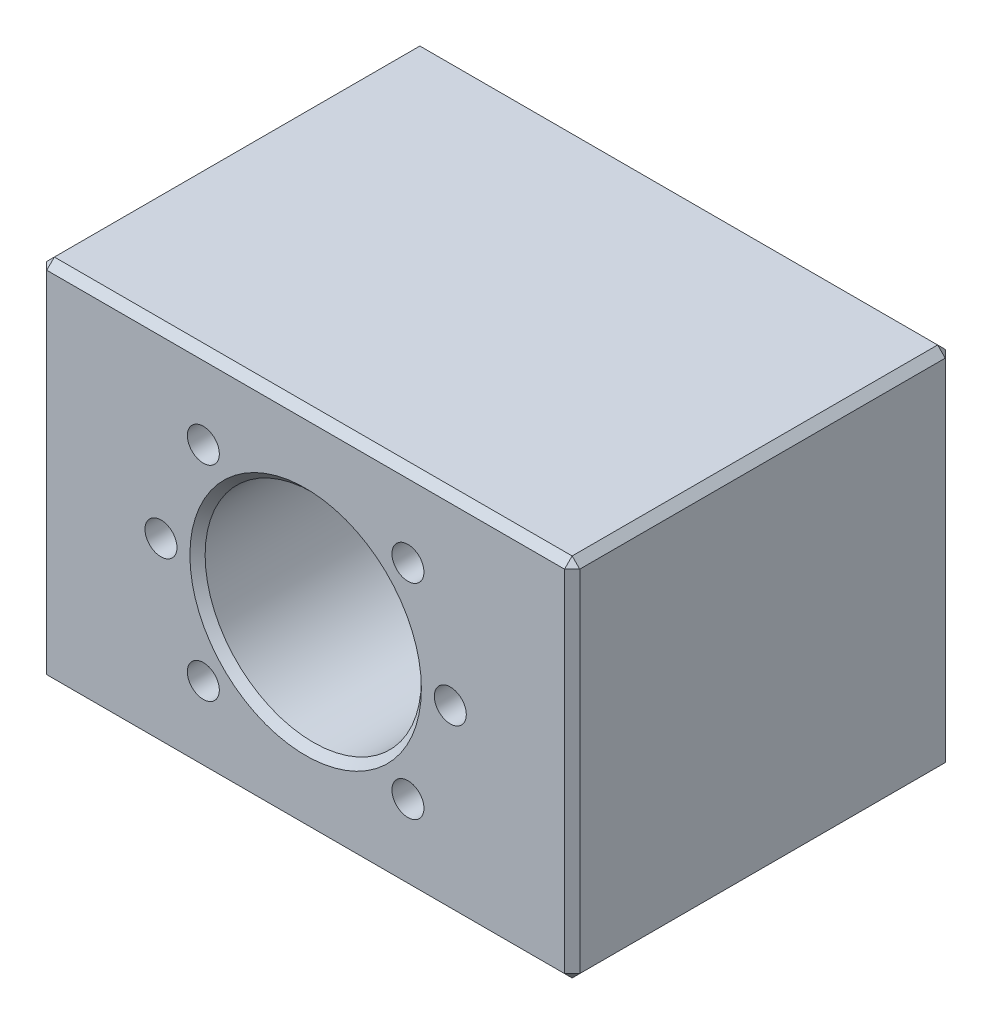
from build123d import *

# Parameters (mm, degrees)
ESQUISSE1_W                                        = 70
ESQUISSE1_H                                        = 50
BOSS_EXTRU_1_DEPTH                                 = 48
D_GAGEMENT_M251_D                                  = 28.4
DIAM_TRE_DU_PER_AGE_4_2_4_2_1_D                    = 4.2
DIAM_TRE_DU_PER_AGE_4_2_4_2_1_DEPTH                = 14
DIAM_TRE_DU_PER_AGE_4_2_4_2_1_TIP                  = 1.2618073
CHAMBRAGE_POUR_VIS_T_TE_HEXAGONALE_M81_D           = 8.6
CHAMBRAGE_POUR_VIS_T_TE_HEXAGONALE_M81_DEPTH       = 20
CHAMBRAGE_POUR_VIS_T_TE_HEXAGONALE_M81_CBORE_D     = 14
CHAMBRAGE_POUR_VIS_T_TE_HEXAGONALE_M81_CBORE_DEPTH = 2
CHAMBRAGE_POUR_VIS_T_TE_HEXAGONALE_M81_TIP         = 2.583700662
CHANFREIN1_SIZE                                    = 0.5
CHANFREIN2_SIZE                                    = 1


with BuildPart() as part:
    # Esquisse1 → Boss.-Extru.1 (new body)
    with BuildSketch(Plane.XZ.offset(24)):
        Rectangle(ESQUISSE1_W, ESQUISSE1_H)
    extrude(amount=-BOSS_EXTRU_1_DEPTH)

    # Dégagement M251 (through all)
    with Locations(Plane(origin=(0, 0, -25), x_dir=(-1, 0, 0), z_dir=(0, 0, -1))):
        with Locations((0, 0)):
            Hole(D_GAGEMENT_M251_D / 2)

    # Diamètre du perçage Ø4.2 (4.2)1
    with Locations(Plane.XY.offset(25)):
        with Locations((13.435028843, -13.435028843), (13.435028843, 13.435028843), (19, 0), (-13.435028843, 13.435028843), (-13.435028843, -13.435028843), (-19, 0)):
            Hole(DIAM_TRE_DU_PER_AGE_4_2_4_2_1_D / 2, depth=DIAM_TRE_DU_PER_AGE_4_2_4_2_1_DEPTH)
            with Locations((0, 0, -(DIAM_TRE_DU_PER_AGE_4_2_4_2_1_DEPTH + DIAM_TRE_DU_PER_AGE_4_2_4_2_1_TIP / 2))):  # 118° drill point
                Cone(0, DIAM_TRE_DU_PER_AGE_4_2_4_2_1_D / 2, DIAM_TRE_DU_PER_AGE_4_2_4_2_1_TIP, mode=Mode.SUBTRACT)

    # Chambrage pour vis à tête hexagonale M81
    with Locations(Plane.XZ.offset(24)):
        with Locations((25, 5), (25, -15), (-25, 5), (-25, -15)):
            CounterBoreHole(CHAMBRAGE_POUR_VIS_T_TE_HEXAGONALE_M81_D / 2, CHAMBRAGE_POUR_VIS_T_TE_HEXAGONALE_M81_CBORE_D / 2, CHAMBRAGE_POUR_VIS_T_TE_HEXAGONALE_M81_CBORE_DEPTH, depth=CHAMBRAGE_POUR_VIS_T_TE_HEXAGONALE_M81_DEPTH)
            with Locations((0, 0, -(CHAMBRAGE_POUR_VIS_T_TE_HEXAGONALE_M81_DEPTH + CHAMBRAGE_POUR_VIS_T_TE_HEXAGONALE_M81_TIP / 2))):  # 118° drill point
                Cone(0, CHAMBRAGE_POUR_VIS_T_TE_HEXAGONALE_M81_D / 2, CHAMBRAGE_POUR_VIS_T_TE_HEXAGONALE_M81_TIP, mode=Mode.SUBTRACT)

    # Chanfrein1
    chanfrein1_edges = [part.edges().sort_by_distance(p)[0] for p in [
        (-32, -24, -15),
        (-32, -24, 5),
        (18, -24, -15),
        (18, -24, 5),
    ]]
    chamfer(chanfrein1_edges, length=CHANFREIN1_SIZE)

    # Chanfrein2
    chanfrein2_edges = [part.edges().sort_by_distance(p)[0] for p in [
        (35, 24, 0),
        (0, 24, 25),
        (-14.2, 0, -25),
        (-14.2, 0, 25),
        (-35, 24, 0),
        (0, -24, 25),
        (35, -24, 0),
        (0, -24, -25),
        (-35, -24, 0),
        (0, 24, -25),
        (-35, 0, 25),
        (35, 0, 25),
        (35, 0, -25),
        (-35, 0, -25),
    ]]
    chamfer(chanfrein2_edges, length=CHANFREIN2_SIZE)


solid = part.part
